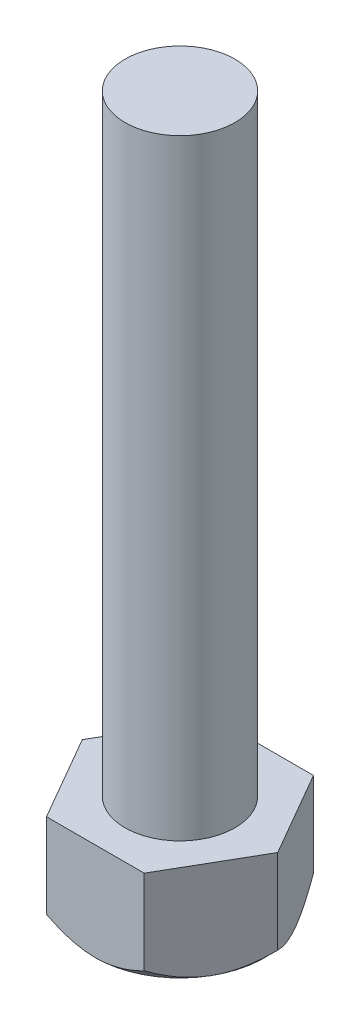
from build123d import *

# Parameters (mm, degrees)
BOSS_EXTRUDE1_DEPTH = 4
SKETCH1_3_R         = 2.25
BOSS_EXTRUDE2_DEPTH = 29
SKETCH3_OUTSIDE_W   = 18.174
SKETCH3_OUTSIDE_H   = 17.102
SKETCH3_OUTSIDE_R   = 3.464101615
CUT_EXTRUDE6_DEPTH  = 1
CUT_EXTRUDE6_DRAFT  = -45


with BuildPart() as part:
    # Sketch1 → Boss-Extrude1 (new body)
    with BuildSketch(Plane(origin=(0, 0, 0), x_dir=(1, 0, 0), z_dir=(0, 1, 0))):
        Polygon((-2, -3.464101615), (2, -3.464101615), (4, 0), (2, 3.464101615), (-2, 3.464101615), (-4, 0), align=None)
    extrude(amount=BOSS_EXTRUDE1_DEPTH)

    # Sketch1<3> → Boss-Extrude2 (add)
    with BuildSketch(Plane(origin=(0, 0, 0), x_dir=(1, 0, 0), z_dir=(0, 1, 0))):
        Circle(SKETCH1_3_R)
    extrude(amount=BOSS_EXTRUDE2_DEPTH)


with BuildPart() as cut_extrude6_tool:
    # Sketch3 outside → Cut-Extrude6 (with draft: the straight prism first)
    with BuildSketch(Plane.XZ):
        Rectangle(SKETCH3_OUTSIDE_W, SKETCH3_OUTSIDE_H)
        Circle(SKETCH3_OUTSIDE_R, mode=Mode.SUBTRACT)
    extrude(amount=-CUT_EXTRUDE6_DEPTH)
    # Cut-Extrude6: the draft: its side faces are tilted about the plane it starts from
    cut_extrude6_sides = [cut_extrude6_tool.faces().sort_by_distance(p)[0] for p in [
        (0, 0.5, -8.551),
        (9.087, 0.5, 0),
        (0, 0.5, 8.551),
        (-9.087, 0.5, 0),
        (-3.464101615, 0.5, 0),
    ]]
    draft(cut_extrude6_sides, Plane.XZ, CUT_EXTRUDE6_DRAFT)


with BuildPart() as part_1:
    add(part.part)

    # Cut-Extrude6: cut by cut_extrude6_tool
    add(cut_extrude6_tool.part, mode=Mode.SUBTRACT)


solid = part_1.part
